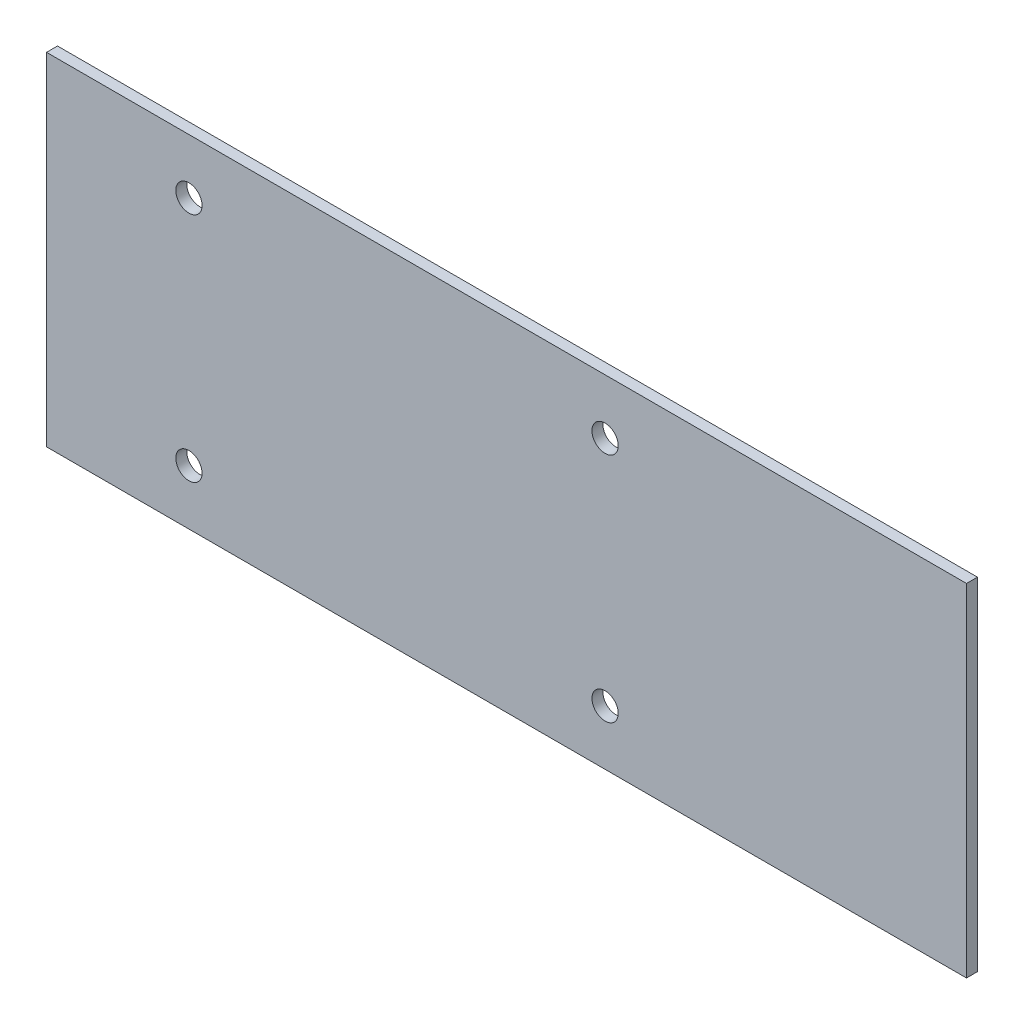
from build123d import *

# Parameters (mm, degrees)
SKETCH1_W           = 420
SKETCH1_H           = 156
SKETCH1_R           = 6
BOSS_EXTRUDE1_DEPTH = 5


with BuildPart() as part:
    # Sketch1 → Boss-Extrude1 (new body)
    with BuildSketch(Plane.XY):
        with Locations((-210, 0)):
            Rectangle(SKETCH1_W, SKETCH1_H)
        with Locations((-355, 52.92)):
            Circle(SKETCH1_R, mode=Mode.SUBTRACT)
        with Locations((-165, 52.92)):
            Circle(SKETCH1_R, mode=Mode.SUBTRACT)
        with Locations((-165, -52.92)):
            Circle(SKETCH1_R, mode=Mode.SUBTRACT)
        with Locations((-355, -52.92)):
            Circle(SKETCH1_R, mode=Mode.SUBTRACT)
    extrude(amount=BOSS_EXTRUDE1_DEPTH)


solid = part.part
